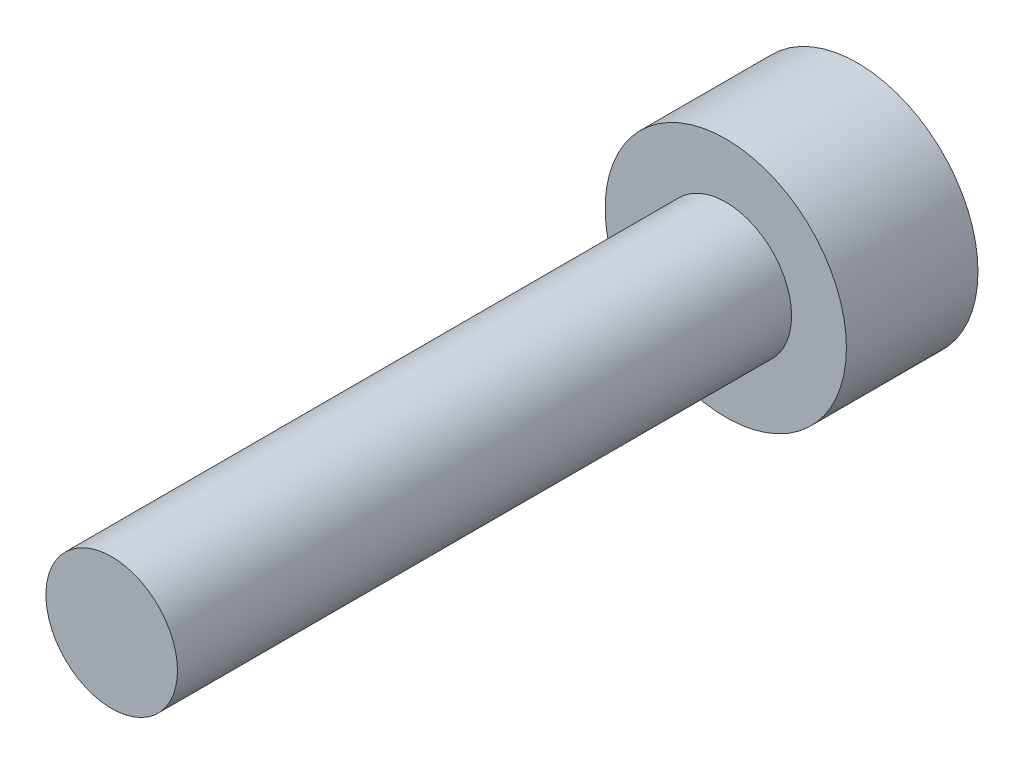
from build123d import *

# Parameters (mm, degrees)
CABEZA_START            = -3
SK_CABEZA_R             = 2.75
CABEZA_DEPTH            = 3
SK_CUERPO_R             = 1.5
CUERPO_DEPTH            = 14
HEXAGONO_INTERIOR_START = -3
HEXAGONO_INTERIOR_DEPTH = 1.5


with BuildPart() as part:
    # Sk_Cabeza → Cabeza (new body)
    with BuildSketch(Plane.XY.offset(CABEZA_START)):
        Circle(SK_CABEZA_R)
    extrude(amount=CABEZA_DEPTH)

    # Sk_Cuerpo → Cuerpo (add)
    with BuildSketch(Plane.XY):
        Circle(SK_CUERPO_R)
    extrude(amount=CUERPO_DEPTH)

    # Sk_Hexagono_interior → Hexagono_interior (cut)
    with BuildSketch(Plane.XY.offset(HEXAGONO_INTERIOR_START)):
        Polygon((0, -1.443375673), (1.25, -0.721687836), (1.25, 0.721687836), (0, 1.443375673), (-1.25, 0.721687836), (-1.25, -0.721687836), align=None)
    extrude(amount=HEXAGONO_INTERIOR_DEPTH, mode=Mode.SUBTRACT)


solid = part.part
